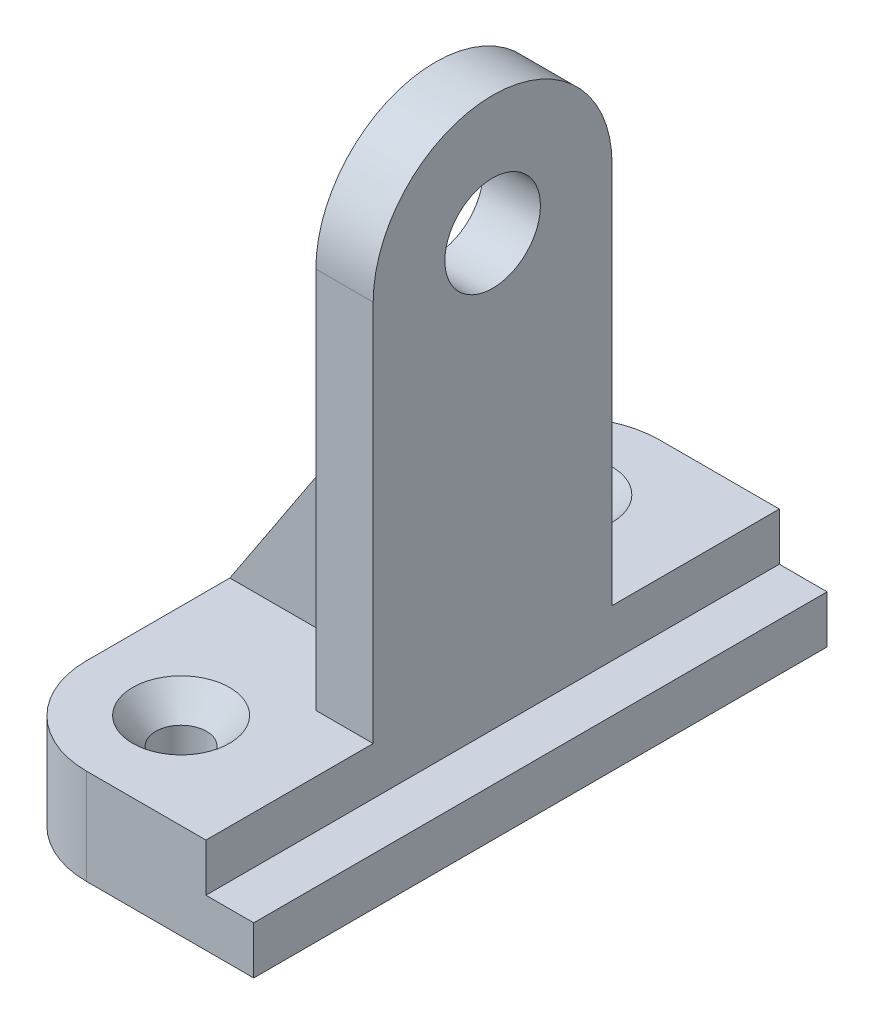
from build123d import *

# Parameters (mm, degrees)
BOSS_EXTRUDE1_DEPTH                              = 38.1
SKETCH2_R                                        = 15.875
SKETCH2_R_2                                      = 6.35
BOSS_EXTRUDE2_DEPTH                              = 7.62
BOSS_EXTRUDE3_DEPTH                              = 6.35
FILLET1_R                                        = 12.7
CSK_FOR_1_4_FLAT_HEAD_MACHINE_SCREW1_D           = 6.7564
CSK_FOR_1_4_FLAT_HEAD_MACHINE_SCREW1_CSINK_D     = 12.8778
CSK_FOR_1_4_FLAT_HEAD_MACHINE_SCREW1_CSINK_ANGLE = 82


with BuildPart() as part:
    # Sketch1 → Boss-Extrude1 (new, symmetric)
    with BuildSketch(Plane.XY):
        Polygon((0, 0), (-34.925, 0), (-34.925, 12.7), (-6.35, 12.7), (-6.35, 6.35), (0, 6.35), align=None)
    extrude(amount=BOSS_EXTRUDE1_DEPTH, both=True)

    # Sketch2 → Boss-Extrude2 (add)
    # profile 1 of 2: a face of its own
    with BuildSketch(Plane(origin=(-6.35, 0, 0), x_dir=(0, 0, -1), z_dir=(1, 0, 0))):
        with BuildLine():
            ThreePointArc((15.875, 63.5), (0, 47.625), (-15.875, 63.5))
            Line((-15.875, 63.5), (-15.875, 12.7))
            Line((-15.875, 12.7), (15.875, 12.7))
            Line((15.875, 12.7), (15.875, 63.5))
        make_face()
    # profile 2 of 2: a face of its own
    with BuildSketch(Plane(origin=(-6.35, 0, 0), x_dir=(0, 0, -1), z_dir=(1, 0, 0))):
        with Locations((0, 63.5)):
            Circle(SKETCH2_R)
        with Locations(Location((0, 63.5, 0), (0, 0, 90))):
            Circle(SKETCH2_R_2, mode=Mode.SUBTRACT)
    extrude(amount=-BOSS_EXTRUDE2_DEPTH)

    # Sketch7 → Boss-Extrude3 (add, symmetric)
    with BuildSketch(Plane.XY):
        Polygon((-13.97, 44.45), (-13.97, 12.7), (-34.925, 12.7), align=None)
    extrude(amount=BOSS_EXTRUDE3_DEPTH, both=True)

    # Fillet1
    fillet1_edges = [part.edges().sort_by_distance(p)[0] for p in [
        (-34.925, 6.35, 38.1),
        (-34.925, 6.35, -38.1),
    ]]
    fillet(fillet1_edges, radius=FILLET1_R)

    # CSK for 1/4 Flat Head Machine Screw1 (through all)
    with Locations(Plane(origin=(0, 12.7, 0), x_dir=(1, 0, 0), z_dir=(0, 1, 0))):
        with Locations((-22.352, 25.4), (-22.352, -25.4)):
            CounterSinkHole(CSK_FOR_1_4_FLAT_HEAD_MACHINE_SCREW1_D / 2, CSK_FOR_1_4_FLAT_HEAD_MACHINE_SCREW1_CSINK_D / 2, counter_sink_angle=CSK_FOR_1_4_FLAT_HEAD_MACHINE_SCREW1_CSINK_ANGLE)


solid = part.part
